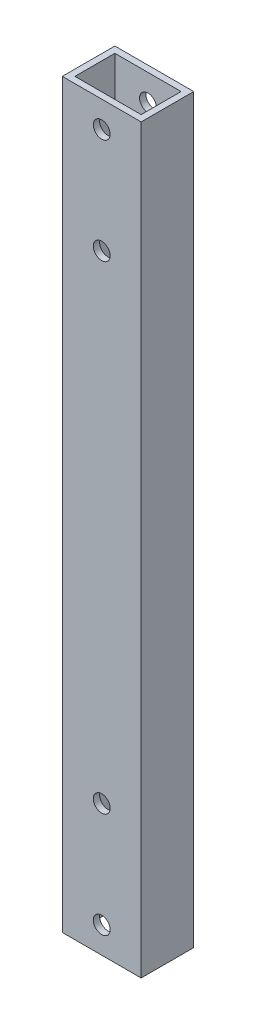
from build123d import *

# Parameters (mm, degrees)
SKETCH_1_W          = 15
SKETCH_1_H          = 10
SKETCH_1_W_2        = 12.6
SKETCH_1_H_2        = 7.6
EXTRUDE_1_DEPTH     = 70.5
SKETCH_2_R          = 1.6
CUT_EXTRUDE_1_DEPTH = 100


with BuildPart() as part:
    # ｽｹｯﾁ1 → ﾎﾞｽ - 押し出し1 (new, symmetric)
    with BuildSketch(Plane(origin=(0, 0, 0), x_dir=(1, 0, 0), z_dir=(0, 1, 0))):
        Rectangle(SKETCH_1_W, SKETCH_1_H)
        Rectangle(SKETCH_1_W_2, SKETCH_1_H_2, mode=Mode.SUBTRACT)
    extrude(amount=EXTRUDE_1_DEPTH, both=True)

    # ｽｹｯﾁ2 → ｶｯﾄ - 押し出し1 (cut)
    with BuildSketch(Plane(origin=(0, 0, -5), x_dir=(-1, 0, 0), z_dir=(0, 0, -1))):
        with Locations((0, -65.5)):
            Circle(SKETCH_2_R)
        with Locations((0, -45.5)):
            Circle(SKETCH_2_R)
        with Locations(Location((0, 45.5, 0), (0, 0, 180))):
            Circle(SKETCH_2_R)
        with Locations(Location((0, 65.5, 0), (0, 0, 180))):
            Circle(SKETCH_2_R)
    extrude(amount=-CUT_EXTRUDE_1_DEPTH, mode=Mode.SUBTRACT)


solid = part.part
